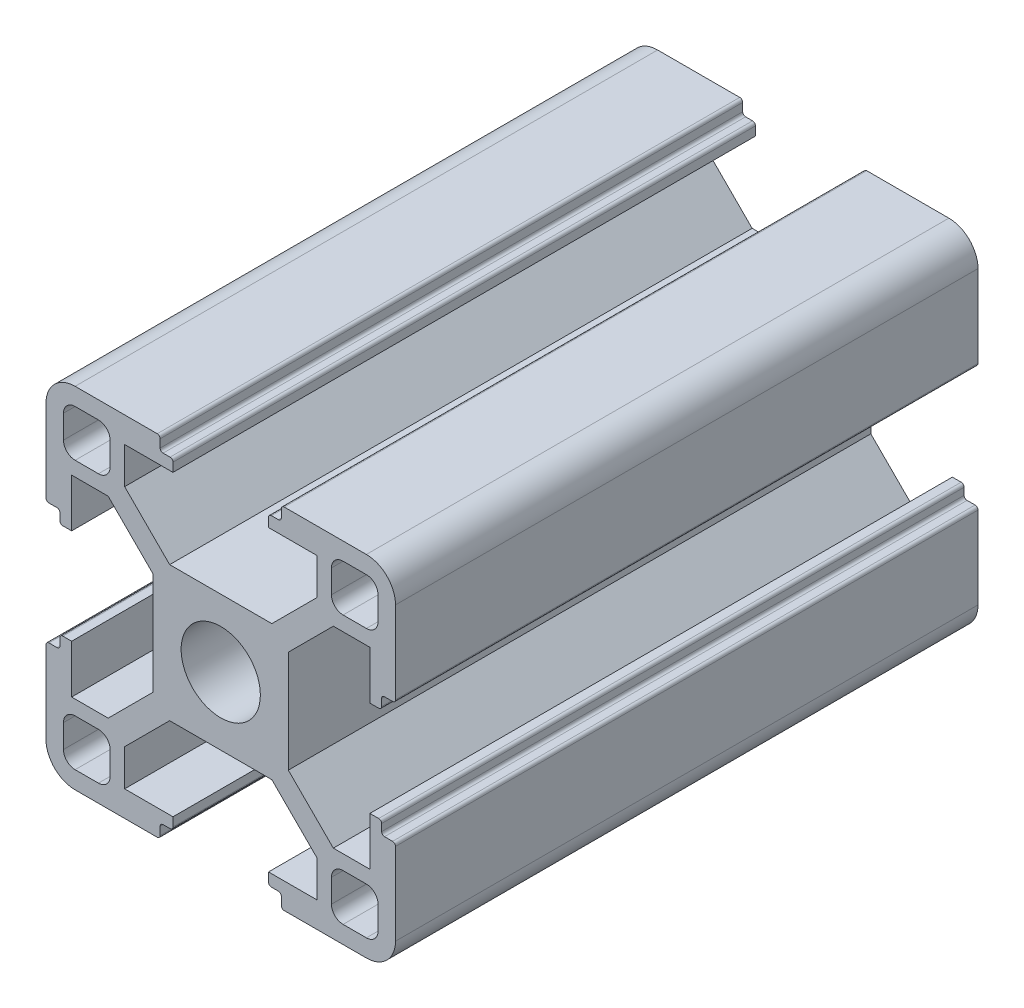
from build123d import *

# Parameters (mm, degrees)
BOSS_EXTRUDE1_DEPTH = 250
SKETCH2_R           = 3.4
CUT_EXTRUDE1_DEPTH  = 251.898385806
FILLET1_R           = 2.5
FILLET2_R           = 0.25
CUT_EXTRUDE3_START  = -200
SKETCH3_R           = 3.4
CUT_EXTRUDE3_DEPTH  = 200


with BuildPart() as part:
    # Sketch1 → Boss-Extrude1 (new body)
    with BuildSketch(Plane.XY):
        Polygon((-15, 15), (-5.2, 15), (-5.2, 13.808325472), (-4.1, 13.808325472), (-4.1, 12.8), (-8.25, 12.8), (-8.25, 9.664213562), (-4.385786438, 5.8), (4.385786438, 5.8), (8.25, 9.664213562), (8.25, 12.8), (4.1, 12.8), (4.1, 13.808325472), (5.2, 13.808325472), (5.2, 15), (15, 15), (15, 5.2), (13.808325472, 5.2), (13.808325472, 4.1), (12.8, 4.1), (12.8, 8.25), (9.664213562, 8.25), (5.8, 4.385786438), (5.8, -4.385786438), (9.664213562, -8.25), (12.8, -8.25), (12.8, -4.1), (13.808325472, -4.1), (13.808325472, -5.2), (15, -5.2), (15, -15), (5.2, -15), (5.2, -13.808325472), (4.1, -13.808325472), (4.1, -12.8), (8.25, -12.8), (8.25, -9.664213562), (4.385786438, -5.8), (-4.385786438, -5.8), (-8.25, -9.664213562), (-8.25, -12.8), (-4.1, -12.8), (-4.1, -13.808325472), (-5.2, -13.808325472), (-5.2, -15), (-15, -15), (-15, -5.2), (-13.808325472, -5.2), (-13.808325472, -4.1), (-12.8, -4.1), (-12.8, -8.25), (-9.664213562, -8.25), (-5.8, -4.385786438), (-5.8, 4.385786438), (-9.664213562, 8.25), (-12.8, 8.25), (-12.8, 4.1), (-13.808325472, 4.1), (-13.808325472, 5.2), (-15, 5.2), align=None)
    extrude(amount=BOSS_EXTRUDE1_DEPTH)

    # Sketch2 → Cut-Extrude1 (cut, through all)
    with BuildSketch(Plane.XY.offset(250)):
        Circle(SKETCH2_R)
        with BuildLine():
            Line((-12.5, 13.5), (-10.5, 13.5))
            ThreePointArc((-10.5, 13.5), (-9.792893219, 13.207106781), (-9.5, 12.5))
            Line((-9.5, 12.5), (-9.5, 10.5))
            ThreePointArc((-9.5, 10.5), (-9.792893219, 9.792893219), (-10.5, 9.5))
            Line((-10.5, 9.5), (-12.5, 9.5))
            ThreePointArc((-12.5, 9.5), (-13.207106781, 9.792893219), (-13.5, 10.5))
            Line((-13.5, 10.5), (-13.5, 12.5))
            ThreePointArc((-13.5, 12.5), (-13.207106781, 13.207106781), (-12.5, 13.5))
        make_face()
        with BuildLine():
            Line((9.5, 12.5), (9.5, 10.5))
            ThreePointArc((9.5, 10.5), (9.792893219, 9.792893219), (10.5, 9.5))
            Line((10.5, 9.5), (12.5, 9.5))
            ThreePointArc((12.5, 9.5), (13.207106781, 9.792893219), (13.5, 10.5))
            Line((13.5, 10.5), (13.5, 12.5))
            ThreePointArc((13.5, 12.5), (13.207106781, 13.207106781), (12.5, 13.5))
            Line((12.5, 13.5), (10.5, 13.5))
            ThreePointArc((10.5, 13.5), (9.792893219, 13.207106781), (9.5, 12.5))
        make_face()
        with BuildLine():
            Line((12.5, -13.5), (10.5, -13.5))
            ThreePointArc((10.5, -13.5), (9.792893219, -13.207106781), (9.5, -12.5))
            Line((9.5, -12.5), (9.5, -10.5))
            ThreePointArc((9.5, -10.5), (9.792893219, -9.792893219), (10.5, -9.5))
            Line((10.5, -9.5), (12.5, -9.5))
            ThreePointArc((12.5, -9.5), (13.207106781, -9.792893219), (13.5, -10.5))
            Line((13.5, -10.5), (13.5, -12.5))
            ThreePointArc((13.5, -12.5), (13.207106781, -13.207106781), (12.5, -13.5))
        make_face()
        with BuildLine():
            Line((-9.5, -12.5), (-9.5, -10.5))
            ThreePointArc((-9.5, -10.5), (-9.792893219, -9.792893219), (-10.5, -9.5))
            Line((-10.5, -9.5), (-12.5, -9.5))
            ThreePointArc((-12.5, -9.5), (-13.207106781, -9.792893219), (-13.5, -10.5))
            Line((-13.5, -10.5), (-13.5, -12.5))
            ThreePointArc((-13.5, -12.5), (-13.207106781, -13.207106781), (-12.5, -13.5))
            Line((-12.5, -13.5), (-10.5, -13.5))
            ThreePointArc((-10.5, -13.5), (-9.792893219, -13.207106781), (-9.5, -12.5))
        make_face()
    extrude(amount=-CUT_EXTRUDE1_DEPTH, mode=Mode.SUBTRACT)

    # Fillet1
    fillet1_edges = [part.edges().sort_by_distance(p)[0] for p in [
        (15, -15, 125),
        (-15, -15, 125),
        (-15, 15, 125),
        (15, 15, 125),
    ]]
    fillet(fillet1_edges, radius=FILLET1_R)

    # Fillet2
    fillet2_edges = [part.edges().sort_by_distance(p)[0] for p in [
        (5.2, -15, 125),
        (5.2, -13.808325472, 125),
        (4.1, -13.808325472, 125),
        (-4.1, -13.808325472, 125),
        (-5.2, -13.808325472, 125),
        (-5.2, -15, 125),
        (-15, -5.2, 125),
        (-13.808325472, -5.2, 125),
        (-13.808325472, -4.1, 125),
        (-13.808325472, 4.1, 125),
        (-13.808325472, 5.2, 125),
        (-15, 5.2, 125),
        (-5.2, 15, 125),
        (-5.2, 13.808325472, 125),
        (-4.1, 13.808325472, 125),
        (4.1, 13.808325472, 125),
        (5.2, 13.808325472, 125),
        (5.2, 15, 125),
        (15, 5.2, 125),
        (13.808325472, 5.2, 125),
        (13.808325472, 4.1, 125),
        (13.808325472, -4.1, 125),
        (13.808325472, -5.2, 125),
        (15, -5.2, 125),
    ]]
    fillet(fillet2_edges, radius=FILLET2_R)

    # Sketch3 → Cut-Extrude3 (cut)
    with BuildSketch(Plane(origin=(0, 0, 0), x_dir=(-1, 0, 0), z_dir=(0, 0, -1)).offset(CUT_EXTRUDE3_START)):
        with BuildLine():
            Line((12.8, 4.1), (13.558325472, 4.1))
            ThreePointArc((13.558325472, 4.1), (13.735102167, 4.173223305), (13.808325472, 4.35))
            Line((13.808325472, 4.35), (13.808325472, 4.95))
            ThreePointArc((13.808325472, 4.95), (13.881548777, 5.126776695), (14.058325472, 5.2))
            Line((14.058325472, 5.2), (14.75, 5.2))
            ThreePointArc((14.75, 5.2), (14.926776695, 5.273223305), (15, 5.45))
            Line((15, 5.45), (15, 12.5))
            ThreePointArc((15, 12.5), (14.267766953, 14.267766953), (12.5, 15))
            Line((12.5, 15), (5.45, 15))
            ThreePointArc((5.45, 15), (5.273223305, 14.926776695), (5.2, 14.75))
            Line((5.2, 14.75), (5.2, 14.058325472))
            ThreePointArc((5.2, 14.058325472), (5.126776695, 13.881548777), (4.95, 13.808325472))
            Line((4.95, 13.808325472), (4.35, 13.808325472))
            ThreePointArc((4.35, 13.808325472), (4.173223305, 13.735102167), (4.1, 13.558325472))
            Line((4.1, 13.558325472), (4.1, 12.8))
            Line((4.1, 12.8), (8.25, 12.8))
            Line((8.25, 12.8), (8.25, 9.664213562))
            Line((8.25, 9.664213562), (4.385786438, 5.8))
            Line((4.385786438, 5.8), (-4.385786438, 5.8))
            Line((-4.385786438, 5.8), (-8.25, 9.664213562))
            Line((-8.25, 9.664213562), (-8.25, 12.8))
            Line((-8.25, 12.8), (-4.1, 12.8))
            Line((-4.1, 12.8), (-4.1, 13.558325472))
            ThreePointArc((-4.1, 13.558325472), (-4.173223305, 13.735102167), (-4.35, 13.808325472))
            Line((-4.35, 13.808325472), (-4.95, 13.808325472))
            ThreePointArc((-4.95, 13.808325472), (-5.126776695, 13.881548777), (-5.2, 14.058325472))
            Line((-5.2, 14.058325472), (-5.2, 14.75))
            ThreePointArc((-5.2, 14.75), (-5.273223305, 14.926776695), (-5.45, 15))
            Line((-5.45, 15), (-12.5, 15))
            ThreePointArc((-12.5, 15), (-14.267766953, 14.267766953), (-15, 12.5))
            Line((-15, 12.5), (-15, 5.45))
            ThreePointArc((-15, 5.45), (-14.926776695, 5.273223305), (-14.75, 5.2))
            Line((-14.75, 5.2), (-14.058325472, 5.2))
            ThreePointArc((-14.058325472, 5.2), (-13.881548777, 5.126776695), (-13.808325472, 4.95))
            Line((-13.808325472, 4.95), (-13.808325472, 4.35))
            ThreePointArc((-13.808325472, 4.35), (-13.735102167, 4.173223305), (-13.558325472, 4.1))
            Line((-13.558325472, 4.1), (-12.8, 4.1))
            Line((-12.8, 4.1), (-12.8, 8.25))
            Line((-12.8, 8.25), (-9.664213562, 8.25))
            Line((-9.664213562, 8.25), (-5.8, 4.385786438))
            Line((-5.8, 4.385786438), (-5.8, -4.385786438))
            Line((-5.8, -4.385786438), (-9.664213562, -8.25))
            Line((-9.664213562, -8.25), (-12.8, -8.25))
            Line((-12.8, -8.25), (-12.8, -4.1))
            Line((-12.8, -4.1), (-13.558325472, -4.1))
            ThreePointArc((-13.558325472, -4.1), (-13.735102167, -4.173223305), (-13.808325472, -4.35))
            Line((-13.808325472, -4.35), (-13.808325472, -4.95))
            ThreePointArc((-13.808325472, -4.95), (-13.881548777, -5.126776695), (-14.058325472, -5.2))
            Line((-14.058325472, -5.2), (-14.75, -5.2))
            ThreePointArc((-14.75, -5.2), (-14.926776695, -5.273223305), (-15, -5.45))
            Line((-15, -5.45), (-15, -12.5))
            ThreePointArc((-15, -12.5), (-14.267766953, -14.267766953), (-12.5, -15))
            Line((-12.5, -15), (-5.45, -15))
            ThreePointArc((-5.45, -15), (-5.273223305, -14.926776695), (-5.2, -14.75))
            Line((-5.2, -14.75), (-5.2, -14.058325472))
            ThreePointArc((-5.2, -14.058325472), (-5.126776695, -13.881548777), (-4.95, -13.808325472))
            Line((-4.95, -13.808325472), (-4.35, -13.808325472))
            ThreePointArc((-4.35, -13.808325472), (-4.173223305, -13.735102167), (-4.1, -13.558325472))
            Line((-4.1, -13.558325472), (-4.1, -12.8))
            Line((-4.1, -12.8), (-8.25, -12.8))
            Line((-8.25, -12.8), (-8.25, -9.664213562))
            Line((-8.25, -9.664213562), (-4.385786438, -5.8))
            Line((-4.385786438, -5.8), (4.385786438, -5.8))
            Line((4.385786438, -5.8), (8.25, -9.664213562))
            Line((8.25, -9.664213562), (8.25, -12.8))
            Line((8.25, -12.8), (4.1, -12.8))
            Line((4.1, -12.8), (4.1, -13.558325472))
            ThreePointArc((4.1, -13.558325472), (4.173223305, -13.735102167), (4.35, -13.808325472))
            Line((4.35, -13.808325472), (4.95, -13.808325472))
            ThreePointArc((4.95, -13.808325472), (5.126776695, -13.881548777), (5.2, -14.058325472))
            Line((5.2, -14.058325472), (5.2, -14.75))
            ThreePointArc((5.2, -14.75), (5.273223305, -14.926776695), (5.45, -15))
            Line((5.45, -15), (12.5, -15))
            ThreePointArc((12.5, -15), (14.267766953, -14.267766953), (15, -12.5))
            Line((15, -12.5), (15, -5.45))
            ThreePointArc((15, -5.45), (14.926776695, -5.273223305), (14.75, -5.2))
            Line((14.75, -5.2), (14.058325472, -5.2))
            ThreePointArc((14.058325472, -5.2), (13.881548777, -5.126776695), (13.808325472, -4.95))
            Line((13.808325472, -4.95), (13.808325472, -4.35))
            ThreePointArc((13.808325472, -4.35), (13.735102167, -4.173223305), (13.558325472, -4.1))
            Line((13.558325472, -4.1), (12.8, -4.1))
            Line((12.8, -4.1), (12.8, -8.25))
            Line((12.8, -8.25), (9.664213562, -8.25))
            Line((9.664213562, -8.25), (5.8, -4.385786438))
            Line((5.8, -4.385786438), (5.8, 4.385786438))
            Line((5.8, 4.385786438), (9.664213562, 8.25))
            Line((9.664213562, 8.25), (12.8, 8.25))
            Line((12.8, 8.25), (12.8, 4.1))
        make_face()
        with Locations(Location((0, 0, 0), (0, 0, 180))):
            Circle(SKETCH3_R, mode=Mode.SUBTRACT)
        with BuildLine():
            Line((-9.5, 12.5), (-9.5, 10.5))
            ThreePointArc((-9.5, 10.5), (-9.792893219, 9.792893219), (-10.5, 9.5))
            Line((-10.5, 9.5), (-12.5, 9.5))
            ThreePointArc((-12.5, 9.5), (-13.207106781, 9.792893219), (-13.5, 10.5))
            Line((-13.5, 10.5), (-13.5, 12.5))
            ThreePointArc((-13.5, 12.5), (-13.207106781, 13.207106781), (-12.5, 13.5))
            Line((-12.5, 13.5), (-10.5, 13.5))
            ThreePointArc((-10.5, 13.5), (-9.792893219, 13.207106781), (-9.5, 12.5))
        make_face(mode=Mode.SUBTRACT)
        with BuildLine():
            Line((12.5, 9.5), (10.5, 9.5))
            ThreePointArc((10.5, 9.5), (9.792893219, 9.792893219), (9.5, 10.5))
            Line((9.5, 10.5), (9.5, 12.5))
            ThreePointArc((9.5, 12.5), (9.792893219, 13.207106781), (10.5, 13.5))
            Line((10.5, 13.5), (12.5, 13.5))
            ThreePointArc((12.5, 13.5), (13.207106781, 13.207106781), (13.5, 12.5))
            Line((13.5, 12.5), (13.5, 10.5))
            ThreePointArc((13.5, 10.5), (13.207106781, 9.792893219), (12.5, 9.5))
        make_face(mode=Mode.SUBTRACT)
        with BuildLine():
            Line((9.5, -12.5), (9.5, -10.5))
            ThreePointArc((9.5, -10.5), (9.792893219, -9.792893219), (10.5, -9.5))
            Line((10.5, -9.5), (12.5, -9.5))
            ThreePointArc((12.5, -9.5), (13.207106781, -9.792893219), (13.5, -10.5))
            Line((13.5, -10.5), (13.5, -12.5))
            ThreePointArc((13.5, -12.5), (13.207106781, -13.207106781), (12.5, -13.5))
            Line((12.5, -13.5), (10.5, -13.5))
            ThreePointArc((10.5, -13.5), (9.792893219, -13.207106781), (9.5, -12.5))
        make_face(mode=Mode.SUBTRACT)
        with BuildLine():
            Line((-9.5, -10.5), (-9.5, -12.5))
            ThreePointArc((-9.5, -12.5), (-9.792893219, -13.207106781), (-10.5, -13.5))
            Line((-10.5, -13.5), (-12.5, -13.5))
            ThreePointArc((-12.5, -13.5), (-13.207106781, -13.207106781), (-13.5, -12.5))
            Line((-13.5, -12.5), (-13.5, -10.5))
            ThreePointArc((-13.5, -10.5), (-13.207106781, -9.792893219), (-12.5, -9.5))
            Line((-12.5, -9.5), (-10.5, -9.5))
            ThreePointArc((-10.5, -9.5), (-9.792893219, -9.792893219), (-9.5, -10.5))
        make_face(mode=Mode.SUBTRACT)
    extrude(amount=CUT_EXTRUDE3_DEPTH, mode=Mode.SUBTRACT)


solid = part.part
